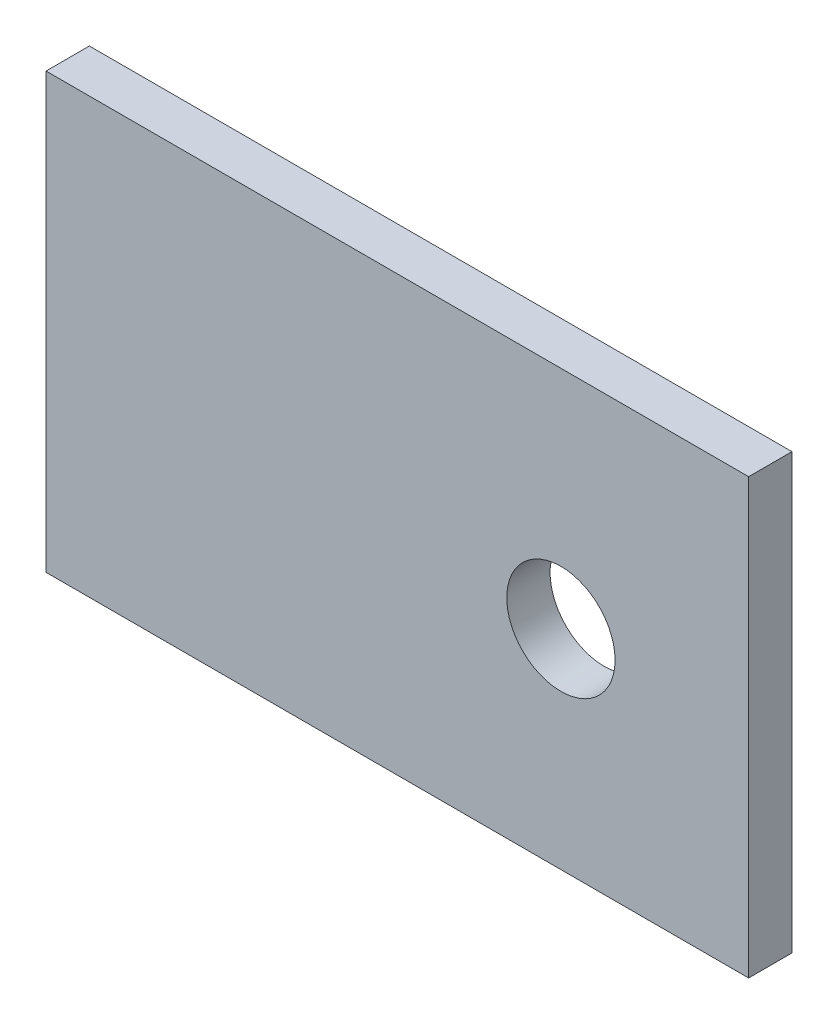
from build123d import *

# Parameters (mm, degrees)
SKETCH_1_W      = 32.427022289
SKETCH_1_H      = 20.037960617
SKETCH_1_R      = 2.5
EXTRUDE_1_DEPTH = 2


with BuildPart() as part:
    # 스케치1 → 보스-돌출1 (new body)
    with BuildSketch(Plane.XY):
        with Locations((-7.549614433, 0.396367893)):
            Rectangle(SKETCH_1_W, SKETCH_1_H)
        Circle(SKETCH_1_R, mode=Mode.SUBTRACT)
    extrude(amount=EXTRUDE_1_DEPTH)


solid = part.part
